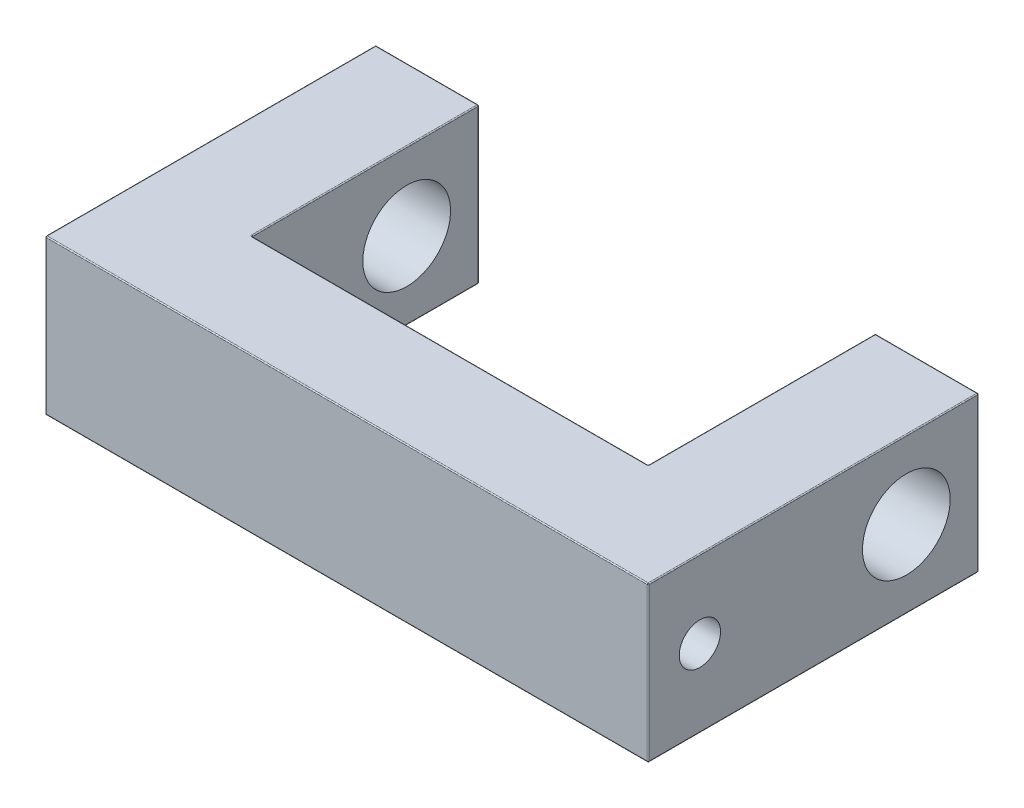
from build123d import *

# Parameters (mm, degrees)
BOSS_EXTRUDE1_DEPTH = 15
SKETCH2_R           = 4.25
CUT_EXTRUDE1_DEPTH  = 69.260969814
SKETCH3_R           = 2
CUT_EXTRUDE2_DEPTH  = 7
CUT_EXTRUDE3_START  = -7
SKETCH4_R           = 2
CUT_EXTRUDE3_DEPTH  = 7
FILLET1_R           = 0.1


with BuildPart() as part:
    # Sketch1 → Boss-Extrude1 (new body)
    with BuildSketch(Plane(origin=(0, 0, 0), x_dir=(1, 0, 0), z_dir=(0, 1, 0))):
        Polygon((48.4, 32), (58.4, 32), (58.4, 0), (0, 0), (0, 32), (10, 32), (10, 10), (48.4, 10), align=None)
    extrude(amount=BOSS_EXTRUDE1_DEPTH)

    # Sketch2 → Cut-Extrude1 (cut, through all)
    with BuildSketch(Plane.ZY):
        with Locations((-25, 7.5)):
            Circle(SKETCH2_R)
    extrude(amount=-CUT_EXTRUDE1_DEPTH, mode=Mode.SUBTRACT)

    # Sketch3 → Cut-Extrude2 (cut)
    with BuildSketch(Plane.ZY):
        with Locations((-5, 7.5)):
            Circle(SKETCH3_R)
    extrude(amount=-CUT_EXTRUDE2_DEPTH, mode=Mode.SUBTRACT)

    # Sketch4 → Cut-Extrude3 (cut)
    with BuildSketch(Plane(origin=(58.4, 0, 0), x_dir=(0, 0, -1), z_dir=(1, 0, 0)).offset(CUT_EXTRUDE3_START)):
        with Locations(Location((5, 7.5, 0), (0, 0, 180))):
            Circle(SKETCH4_R)
    extrude(amount=CUT_EXTRUDE3_DEPTH, mode=Mode.SUBTRACT)

    # Fillet1
    fillet1_edges = [part.edges().sort_by_distance(p)[0] for p in [
        (58.4, 15, -16),
        (29.2, 0, 0),
        (0, 0, -16),
        (53.4, 15, -32),
        (0, 7.5, -32),
        (10, 7.5, -32),
        (10, 7.5, -10),
        (48.4, 7.5, -10),
        (48.4, 7.5, -32),
        (58.4, 7.5, -32),
        (58.4, 7.5, 0),
        (0, 7.5, 0),
        (48.4, 15, -21),
        (29.2, 15, -10),
        (10, 15, -21),
        (5, 15, -32),
        (0, 15, -16),
        (29.2, 15, 0),
        (5, 0, -32),
        (10, 0, -21),
        (29.2, 0, -10),
        (48.4, 0, -21),
        (53.4, 0, -32),
        (58.4, 0, -16),
    ]]
    fillet(fillet1_edges, radius=FILLET1_R)


solid = part.part
